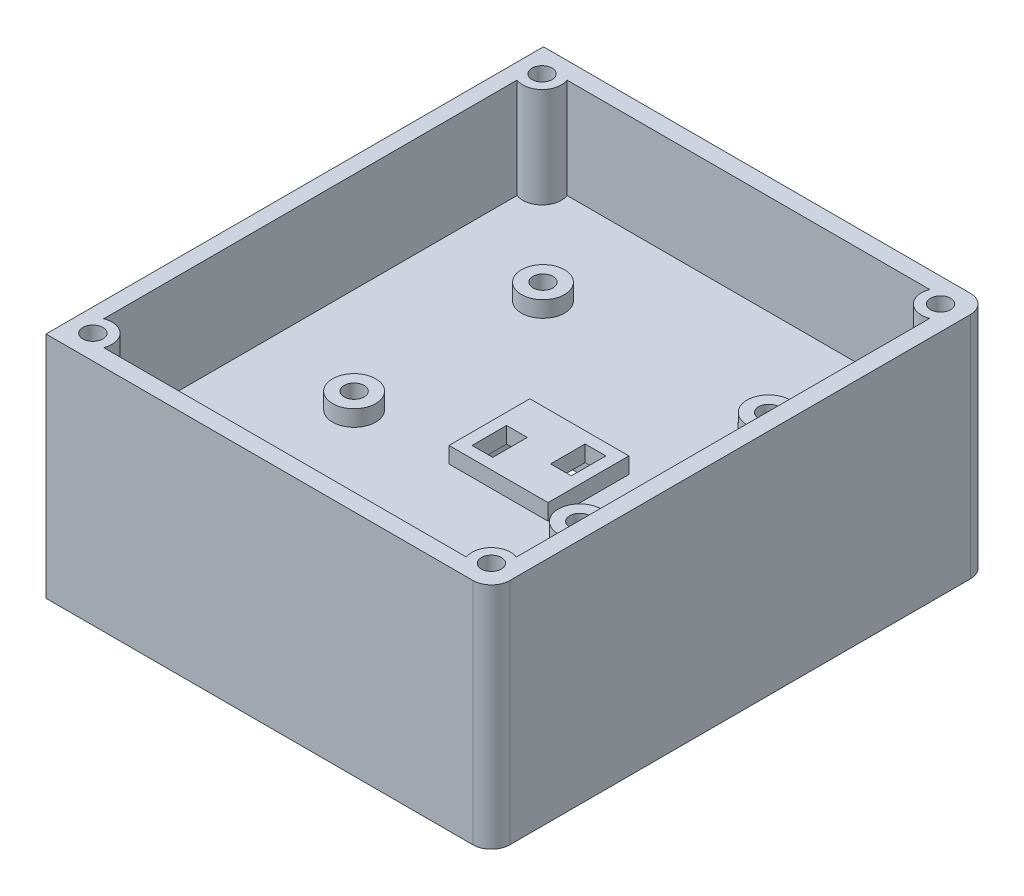
from build123d import *

# Parameters (mm, degrees)
SKETCH1_W           = 89.6
SKETCH1_H           = 100.6
BOSS_EXTRUDE1_DEPTH = 49.7
SKETCH4_W           = 16.6
SKETCH4_H           = 12
CUT_EXTRUDE1_DEPTH  = 120.117546986
SKETCH5_W           = 100.6
SKETCH5_H           = 3
BOSS_EXTRUDE2_DEPTH = 89.6
SKETCH7_R           = 4.175
BOSS_EXTRUDE3_DEPTH = 21.7
CUT_EXTRUDE2_START  = 21.7
SKETCH7_3_R         = 2.175
CUT_EXTRUDE2_DEPTH  = 5
SKETCH9_R           = 4.675
SKETCH9_R_2         = 2.175
BOSS_EXTRUDE4_DEPTH = 3.5
CUT_EXTRUDE4_START  = -1.5
SKETCH9_2_R         = 2.175
CUT_EXTRUDE4_DEPTH  = 1.5
SKETCH11_W          = 21.5
SKETCH11_H          = 17.55
SKETCH11_W_2        = 4.5
SKETCH11_H_2        = 7.5
BOSS_EXTRUDE5_DEPTH = 3.5
SKETCH12_W          = 17
SKETCH12_H          = 13.05
CUT_EXTRUDE5_DEPTH  = 3


with BuildPart() as part:
    # Sketch1 → Boss-Extrude1 (new body)
    with BuildSketch(Plane(origin=(0, 0, 0), x_dir=(1, 0, 0), z_dir=(0, 1, 0))):
        with BuildLine():
            Line((73.990371034, 53.1), (166.690371034, 53.1))
            ThreePointArc((166.690371034, 53.1), (169.518798158, 51.928427125), (170.690371034, 49.1))
            Line((170.690371034, 49.1), (170.690371034, -50.9))
            ThreePointArc((170.690371034, -50.9), (169.518798158, -53.728427125), (166.690371034, -54.9))
            Line((166.690371034, -54.9), (73.990371034, -54.9))
            Line((73.990371034, -54.9), (73.990371034, 53.1))
        make_face()
        with Locations((122.190371034, -0.9)):
            Rectangle(SKETCH1_W, SKETCH1_H, mode=Mode.SUBTRACT)
    extrude(amount=BOSS_EXTRUDE1_DEPTH)

    # Sketch4 → Cut-Extrude1 (cut, through all)
    with BuildSketch(Plane(origin=(77.390371034, 0, 0), x_dir=(0, 0, -1), z_dir=(1, 0, 0))):
        with Locations((37.1, 6)):
            Rectangle(SKETCH4_W, SKETCH4_H)
    extrude(amount=-CUT_EXTRUDE1_DEPTH, mode=Mode.SUBTRACT)

    # Sketch5 → Boss-Extrude2 (add)
    with BuildSketch(Plane(origin=(77.390371034, 0, 0), x_dir=(0, 0, -1), z_dir=(1, 0, 0))):
        with Locations((-0.9, 26.5)):
            Rectangle(SKETCH5_W, SKETCH5_H)
    extrude(amount=BOSS_EXTRUDE2_DEPTH)

    # Sketch7 → Boss-Extrude3 (add)
    with BuildSketch(Plane(origin=(0, 28, 0), x_dir=(1, 0, 0), z_dir=(0, 1, 0))):
        with Locations((78.928328283, 47.862042751)):
            Circle(SKETCH7_R)
        with Locations((165.452413785, 47.862042751)):
            Circle(SKETCH7_R)
        with Locations((165.452413785, -49.662042751)):
            Circle(SKETCH7_R)
        with Locations((78.928328283, -49.662042751)):
            Circle(SKETCH7_R)
    extrude(amount=BOSS_EXTRUDE3_DEPTH)

    # Sketch7<3> → Cut-Extrude2 (cut)
    with BuildSketch(Plane(origin=(0, 28, 0), x_dir=(1, 0, 0), z_dir=(0, 1, 0)).offset(CUT_EXTRUDE2_START)):
        with Locations(Location((78.928328283, 47.862042751, 0), (0, 0, 270))):
            Circle(SKETCH7_3_R)
        with Locations(Location((165.452413785, 47.862042751, 0), (0, 0, 270))):
            Circle(SKETCH7_3_R)
        with Locations(Location((165.452413785, -49.662042751, 0), (0, 0, 270))):
            Circle(SKETCH7_3_R)
        with Locations(Location((78.928328283, -49.662042751, 0), (0, 0, 270))):
            Circle(SKETCH7_3_R)
    extrude(amount=-CUT_EXTRUDE2_DEPTH, mode=Mode.SUBTRACT)

    # Sketch9 → Boss-Extrude4 (add)
    # profile 1 of 4: a face of its own
    with BuildSketch(Plane(origin=(0, 28, 0), x_dir=(1, 0, 0), z_dir=(0, 1, 0))):
        with Locations(Location((148.990371034, -14, 0), (0, 0, 90))):
            Circle(SKETCH9_R)
        with Locations(Location((148.990371034, -14, 0), (0, 0, 270))):
            Circle(SKETCH9_R_2, mode=Mode.SUBTRACT)
    # profile 2 of 4: a face of its own
    with BuildSketch(Plane(origin=(0, 28, 0), x_dir=(1, 0, 0), z_dir=(0, 1, 0))):
        with Locations(Location((99.990371034, -14, 0), (0, 0, 90))):
            Circle(SKETCH9_R)
        with Locations(Location((99.990371034, -14, 0), (0, 0, 270))):
            Circle(SKETCH9_R_2, mode=Mode.SUBTRACT)
    # profile 3 of 4: a face of its own
    with BuildSketch(Plane(origin=(0, 28, 0), x_dir=(1, 0, 0), z_dir=(0, 1, 0))):
        with Locations(Location((99.990371034, 27, 0), (0, 0, 90))):
            Circle(SKETCH9_R)
        with Locations(Location((99.990371034, 27, 0), (0, 0, 270))):
            Circle(SKETCH9_R_2, mode=Mode.SUBTRACT)
    # profile 4 of 4: a face of its own
    with BuildSketch(Plane(origin=(0, 28, 0), x_dir=(1, 0, 0), z_dir=(0, 1, 0))):
        with Locations(Location((148.990371034, 27, 0), (0, 0, 90))):
            Circle(SKETCH9_R)
        with Locations(Location((148.990371034, 27, 0), (0, 0, 270))):
            Circle(SKETCH9_R_2, mode=Mode.SUBTRACT)
    extrude(amount=BOSS_EXTRUDE4_DEPTH)

    # Sketch9<2> → Cut-Extrude4 (cut)
    with BuildSketch(Plane(origin=(0, 28, 0), x_dir=(1, 0, 0), z_dir=(0, 1, 0)).offset(CUT_EXTRUDE4_START)):
        with Locations(Location((99.990371034, 27, 0), (0, 0, 270))):
            Circle(SKETCH9_2_R)
        with Locations(Location((148.990371034, 27, 0), (0, 0, 270))):
            Circle(SKETCH9_2_R)
        with Locations(Location((99.990371034, -14, 0), (0, 0, 270))):
            Circle(SKETCH9_2_R)
        with Locations(Location((148.990371034, -14, 0), (0, 0, 270))):
            Circle(SKETCH9_2_R)
    extrude(amount=CUT_EXTRUDE4_DEPTH, mode=Mode.SUBTRACT)

    # Sketch11 → Boss-Extrude5 (add)
    with BuildSketch(Plane(origin=(0, 28, 0), x_dir=(1, 0, 0), z_dir=(0, 1, 0))):
        with Locations((131.240371034, -5.125)):
            Rectangle(SKETCH11_W, SKETCH11_H)
        with Locations((125.240371034, -7.65)):
            Rectangle(SKETCH11_W_2, SKETCH11_H_2, mode=Mode.SUBTRACT)
        with Locations((137.240371034, -2.6)):
            Rectangle(SKETCH11_W_2, SKETCH11_H_2, mode=Mode.SUBTRACT)
    extrude(amount=BOSS_EXTRUDE5_DEPTH)

    # Sketch12 → Cut-Extrude5 (cut)
    with BuildSketch(Plane.XZ.offset(-25)):
        with Locations((131.240371034, 5.125)):
            Rectangle(SKETCH12_W, SKETCH12_H)
    extrude(amount=-CUT_EXTRUDE5_DEPTH, mode=Mode.SUBTRACT)


solid = part.part
